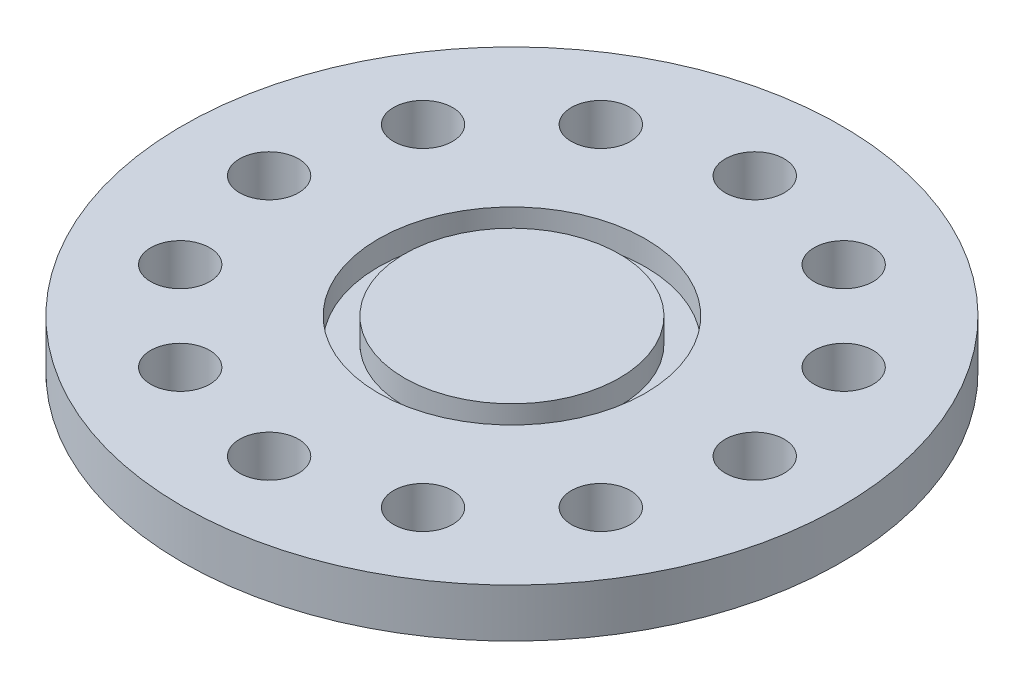
from build123d import *

# Parameters (mm, degrees)
SKETCH_1_R          = 9.5
SKETCH_1_R_2        = 0.85
EXTRUDE_1_DEPTH     = 1.4
SKETCH_2_R          = 3.85
SKETCH_2_R_2        = 3.1
CUT_EXTRUDE_1_DEPTH = 0.7
EXTRUDE_2_DEPTH     = 3


with BuildPart() as part:
    # 스케치1 → 보스-돌출1 (new body)
    with BuildSketch(Plane(origin=(0, 0, 0), x_dir=(1, 0, 0), z_dir=(0, 1, 0))):
        with Locations(Location((0, 0, 0), (0, 0, 270))):
            Circle(SKETCH_1_R)
        with Locations(Location((0, 7, 0), (0, 0, 270))):
            Circle(SKETCH_1_R_2, mode=Mode.SUBTRACT)
        with Locations(Location((3.5, 6.062177826, 0), (0, 0, 270))):
            Circle(SKETCH_1_R_2, mode=Mode.SUBTRACT)
        with Locations(Location((6.062177826, 3.5, 0), (0, 0, 270))):
            Circle(SKETCH_1_R_2, mode=Mode.SUBTRACT)
        with Locations(Location((7, 0, 0), (0, 0, 270))):
            Circle(SKETCH_1_R_2, mode=Mode.SUBTRACT)
        with Locations(Location((6.062177826, -3.5, 0), (0, 0, 270))):
            Circle(SKETCH_1_R_2, mode=Mode.SUBTRACT)
        with Locations(Location((3.5, -6.062177826, 0), (0, 0, 270))):
            Circle(SKETCH_1_R_2, mode=Mode.SUBTRACT)
        with Locations(Location((0, -7, 0), (0, 0, 270))):
            Circle(SKETCH_1_R_2, mode=Mode.SUBTRACT)
        with Locations(Location((-3.5, -6.062177826, 0), (0, 0, 270))):
            Circle(SKETCH_1_R_2, mode=Mode.SUBTRACT)
        with Locations(Location((-6.062177826, -3.5, 0), (0, 0, 270))):
            Circle(SKETCH_1_R_2, mode=Mode.SUBTRACT)
        with Locations(Location((-7, 0, 0), (0, 0, 270))):
            Circle(SKETCH_1_R_2, mode=Mode.SUBTRACT)
        with Locations(Location((-6.062177826, 3.5, 0), (0, 0, 270))):
            Circle(SKETCH_1_R_2, mode=Mode.SUBTRACT)
        with Locations(Location((-3.5, 6.062177826, 0), (0, 0, 270))):
            Circle(SKETCH_1_R_2, mode=Mode.SUBTRACT)
    extrude(amount=EXTRUDE_1_DEPTH)

    # 스케치2 → 컷-돌출1 (cut)
    with BuildSketch(Plane(origin=(0, 1.4, 0), x_dir=(1, 0, 0), z_dir=(0, 1, 0))):
        with Locations(Location((0, 0, 0), (0, 0, 270))):
            Circle(SKETCH_2_R)
        with Locations(Location((0, 0, 0), (0, 0, 270))):
            Circle(SKETCH_2_R_2, mode=Mode.SUBTRACT)
    extrude(amount=-CUT_EXTRUDE_1_DEPTH, mode=Mode.SUBTRACT)

    # 스케치3 → 보스-돌출2 (add)
    with BuildSketch(Plane.XZ):
        with BuildLine():
            Line((-0.8, 2.891366459), (-0.8, 3.8))
            Line((-0.8, 3.8), (0.8, 3.8))
            Line((0.8, 3.8), (0.8, 2.891366459))
            ThreePointArc((0.8, 2.891366459), (0, -3), (-0.8, 2.891366459))
        make_face()
    extrude(amount=EXTRUDE_2_DEPTH)


solid = part.part
